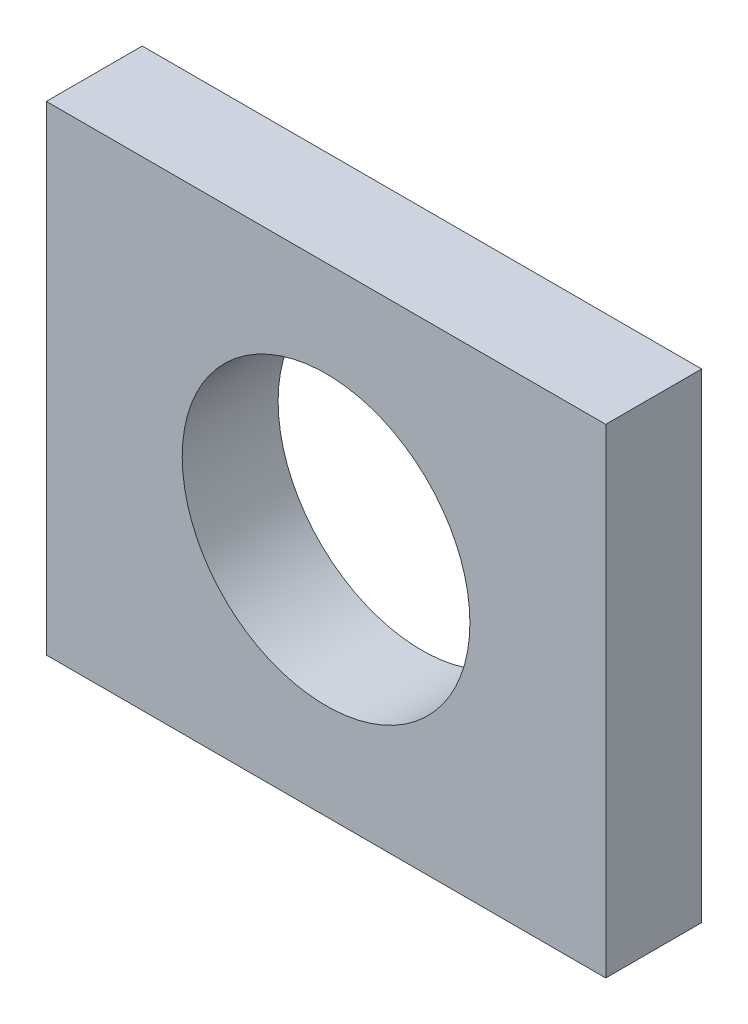
from build123d import *

# Parameters (mm, degrees)
SKETCH_1_W          = 70
SKETCH_1_H          = 60
EXTRUDE_1_DEPTH     = 12
CUT_EXTRUDE_1_REACH = 49.634
SKETCH_2_R          = 18


with BuildPart() as part:
    # 草图1 → 凸台-拉伸1 (new body)
    with BuildSketch(Plane.XY):
        Rectangle(SKETCH_1_W, SKETCH_1_H)
    extrude(amount=EXTRUDE_1_DEPTH)

    # 草图2 → 切除-拉伸1 (cut, up to next)
    with BuildSketch(Plane(origin=(0, 0, 0), x_dir=(-1, 0, 0), z_dir=(0, 0, -1)), mode=Mode.PRIVATE) as cut_extrude_1_sk1:
        Circle(SKETCH_2_R)
    cut_extrude_1_tool1 = extrude(cut_extrude_1_sk1.sketch, amount=-CUT_EXTRUDE_1_REACH, mode=Mode.PRIVATE) & part.part
    add(cut_extrude_1_tool1.solids().sort_by_distance((0, 0, 0))[0], mode=Mode.SUBTRACT)


solid = part.part
